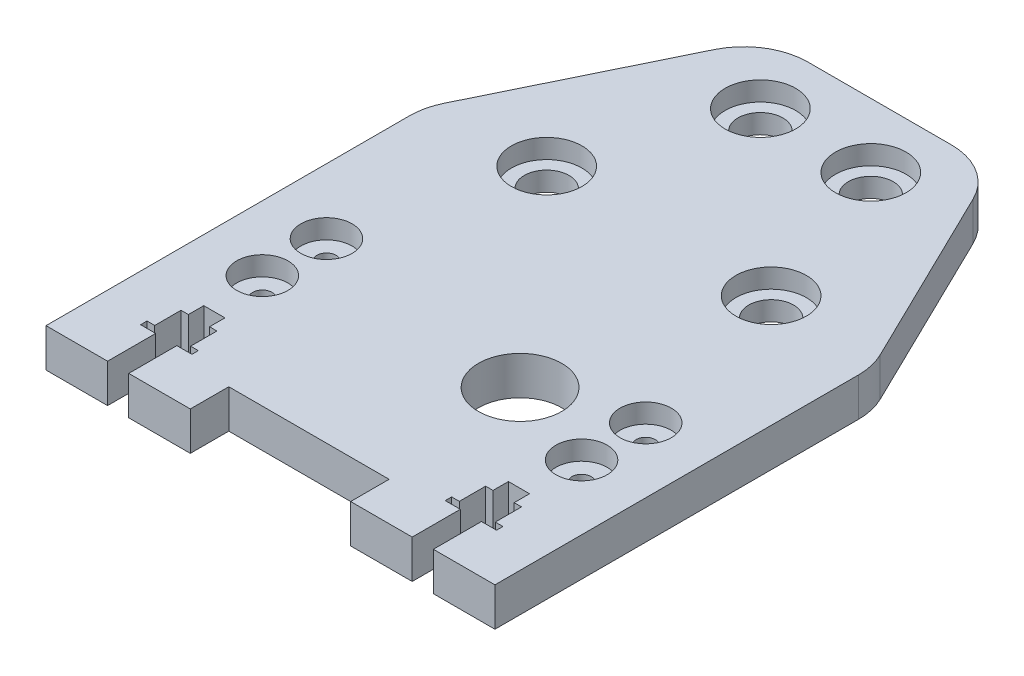
from build123d import *

# Parameters (mm, degrees)
SKETCH1_R           = 1.5
SKETCH1_R_2         = 6.5
SKETCH1_R_3         = 5.5
BOSS_EXTRUDE1_DEPTH = 6
FILLET1_R           = 10
SKETCH2_R           = 4
CUT_EXTRUDE1_DEPTH  = 3
SKETCH1_3_R         = 5.5
SKETCH1_3_R_2       = 3.5
BOSS_EXTRUDE2_DEPTH = 3
CUT_EXTRUDE2_DEPTH  = 10


with BuildPart() as part:
    # Sketch1 → Boss-Extrude1 (new body)
    with BuildSketch(Plane(origin=(0, 0, 0), x_dir=(1, 0, 0), z_dir=(0, 1, 0))):
        Polygon((17.441626812, 0.78), (-17.441626812, 0.78), (-35, -35.22), (-35, -94.22), (-12.5, -94.22), (-12.5, -88.22), (12.5, -88.22), (12.5, -94.22), (35, -94.22), (35, -35.22), align=None)
        with Locations((-24.889613301, -70.60075616)):
            Circle(SKETCH1_R, mode=Mode.SUBTRACT)
        with Locations((-24.889613301, -60.60075616)):
            Circle(SKETCH1_R, mode=Mode.SUBTRACT)
        with Locations((24.889613301, -70.60075616)):
            Circle(SKETCH1_R, mode=Mode.SUBTRACT)
        with Locations((10.3, -65.60075616)):
            Circle(SKETCH1_R_2, mode=Mode.SUBTRACT)
        with Locations((24.889613301, -60.60075616)):
            Circle(SKETCH1_R, mode=Mode.SUBTRACT)
        with Locations((-17.5, -33.65200814)):
            Circle(SKETCH1_R_3, mode=Mode.SUBTRACT)
        with Locations((-8.607476274, -9.22)):
            Circle(SKETCH1_R_3, mode=Mode.SUBTRACT)
        with Locations((17.5, -33.65200814)):
            Circle(SKETCH1_R_3, mode=Mode.SUBTRACT)
        with Locations((8.607476274, -9.22)):
            Circle(SKETCH1_R_3, mode=Mode.SUBTRACT)
    extrude(amount=BOSS_EXTRUDE1_DEPTH)

    # Fillet1
    fillet1_edges = [part.edges().sort_by_distance(p)[0] for p in [
        (35, 3, 35.22),
        (17.441626812, 3, -0.78),
        (-17.441626812, 3, -0.78),
        (-35, 3, 35.22),
    ]]
    fillet(fillet1_edges, radius=FILLET1_R)

    # Sketch2 → Cut-Extrude1 (cut)
    with BuildSketch(Plane(origin=(0, 6, 0), x_dir=(1, 0, 0), z_dir=(0, 1, 0))):
        with Locations((24.889613301, -60.60075616)):
            Circle(SKETCH2_R)
        with Locations((24.889613301, -70.60075616)):
            Circle(SKETCH2_R)
        with Locations((-24.889613301, -60.60075616)):
            Circle(SKETCH2_R)
        with Locations((-24.889613301, -70.60075616)):
            Circle(SKETCH2_R)
    extrude(amount=-CUT_EXTRUDE1_DEPTH, mode=Mode.SUBTRACT)

    # Sketch1<3> → Boss-Extrude2 (add)
    # profile 1 of 4: a face of its own
    with BuildSketch(Plane(origin=(0, 0, 0), x_dir=(1, 0, 0), z_dir=(0, 1, 0))):
        with Locations((8.607476274, -9.22)):
            Circle(SKETCH1_3_R)
        with Locations((8.607476274, -9.22)):
            Circle(SKETCH1_3_R_2, mode=Mode.SUBTRACT)
    # profile 2 of 4: a face of its own
    with BuildSketch(Plane(origin=(0, 0, 0), x_dir=(1, 0, 0), z_dir=(0, 1, 0))):
        with Locations((-8.607476274, -9.22)):
            Circle(SKETCH1_3_R)
        with Locations((-8.607476274, -9.22)):
            Circle(SKETCH1_3_R_2, mode=Mode.SUBTRACT)
    # profile 3 of 4: a face of its own
    with BuildSketch(Plane(origin=(0, 0, 0), x_dir=(1, 0, 0), z_dir=(0, 1, 0))):
        with Locations((-17.5, -33.65200814)):
            Circle(SKETCH1_3_R)
        with Locations((-17.5, -33.65200814)):
            Circle(SKETCH1_3_R_2, mode=Mode.SUBTRACT)
    # profile 4 of 4: a face of its own
    with BuildSketch(Plane(origin=(0, 0, 0), x_dir=(1, 0, 0), z_dir=(0, 1, 0))):
        with Locations((17.5, -33.65200814)):
            Circle(SKETCH1_3_R)
        with Locations((17.5, -33.65200814)):
            Circle(SKETCH1_3_R_2, mode=Mode.SUBTRACT)
    extrude(amount=BOSS_EXTRUDE2_DEPTH)

    # Sketch3 → Cut-Extrude2 (cut)
    with BuildSketch(Plane(origin=(0, 6, 0), x_dir=(1, 0, 0), z_dir=(0, 1, 0))):
        Polygon((22.1, -81.62), (20.95, -81.62), (20.95, -85.72), (19.75, -85.72), (19.75, -86.72), (22.1, -86.72), (22.1, -94.22), (25.4, -94.22), (25.4, -86.72), (27.75, -86.72), (27.75, -85.72), (26.55, -85.72), (26.55, -81.62), (25.4, -81.62), (25.4, -79.22), (22.1, -79.22), align=None)
    cut_extrude2 = extrude(amount=-CUT_EXTRUDE2_DEPTH, mode=Mode.SUBTRACT)

    # Mirror1: Cut-Extrude2 across plane
    add(cut_extrude2.mirror(Plane(origin=(0, 0, 0), x_dir=(0, 0, 1), z_dir=(1, 0, 0))), mode=Mode.SUBTRACT)


solid = part.part
